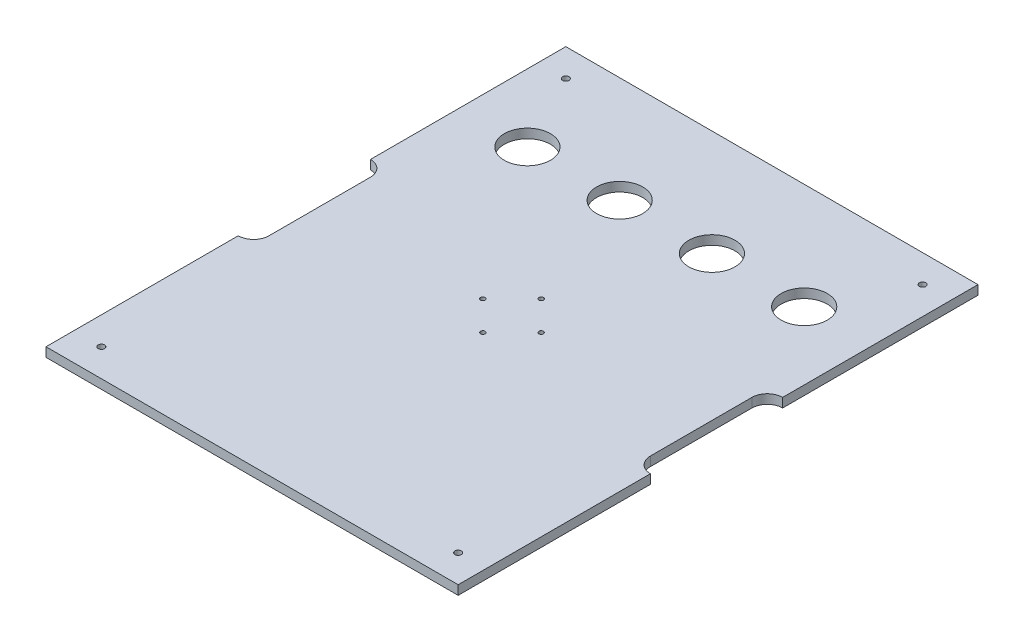
from build123d import *

# Parameters (mm, degrees)
RESSALTO_EXTRUS_O1_DEPTH     = 6
FURO_ROSCADO_DE_M41_D        = 3
ESBO_O6_R                    = 15
CORTE_EXTRUS_O1_DEPTH        = 216.761442339
FURO_DE_DI_METRO_4_2_4_2_1_D = 4.2


with BuildPart() as part:
    # Esboço1 → Ressalto-extrusão1 (new body)
    with BuildSketch(Plane(origin=(0, 0, 0), x_dir=(1, 0, 0), z_dir=(0, 1, 0))):
        with BuildLine():
            Line((-134, -169), (134, -169))
            Line((134, -169), (134, -44))
            ThreePointArc((134, -44), (126.928932188, -41.071067812), (124, -34))
            Line((124, -34), (124, 32))
            ThreePointArc((124, 32), (126.928932188, 39.071067812), (134, 42))
            Line((134, 42), (134, 169))
            Line((134, 169), (-134, 169))
            Line((-134, 169), (-134, 42))
            ThreePointArc((-134, 42), (-126.928932188, 39.071067812), (-124, 32))
            Line((-124, 32), (-124, -34))
            ThreePointArc((-124, -34), (-126.928932188, -41.071067812), (-134, -44))
            Line((-134, -44), (-134, -169))
        make_face()
    extrude(amount=RESSALTO_EXTRUS_O1_DEPTH)

    # Furo roscado de M41 (through all)
    with Locations(Plane(origin=(0, 0, 0), x_dir=(-1, 0, 0), z_dir=(0, -1, 0))):
        with Locations((19, 0), (0, 19), (-19, 0), (0, -19)):
            Hole(FURO_ROSCADO_DE_M41_D / 2)

    # Esboço6 → Corte-extrusão1 (cut, through all)
    with BuildSketch(Plane(origin=(0, 6, 0), x_dir=(1, 0, 0), z_dir=(0, 1, 0))):
        with Locations(Location((-90, 100, 0), (0, 0, 270))):
            Circle(ESBO_O6_R)
        with Locations(Location((-30, 100, 0), (0, 0, 270))):
            Circle(ESBO_O6_R)
        with Locations(Location((30, 100, 0), (0, 0, 270))):
            Circle(ESBO_O6_R)
        with Locations(Location((90, 100, 0), (0, 0, 270))):
            Circle(ESBO_O6_R)
    extrude(amount=-CORTE_EXTRUS_O1_DEPTH, mode=Mode.SUBTRACT)

    # Furo de diâmetro Ø4.2 (4.2)1 (through all)
    with Locations(Plane(origin=(0, 0, 0), x_dir=(-1, 0, 0), z_dir=(0, -1, 0))):
        with Locations((-116, 151), (-116, -151), (116, 151), (116, -151)):
            Hole(FURO_DE_DI_METRO_4_2_4_2_1_D / 2)


solid = part.part
